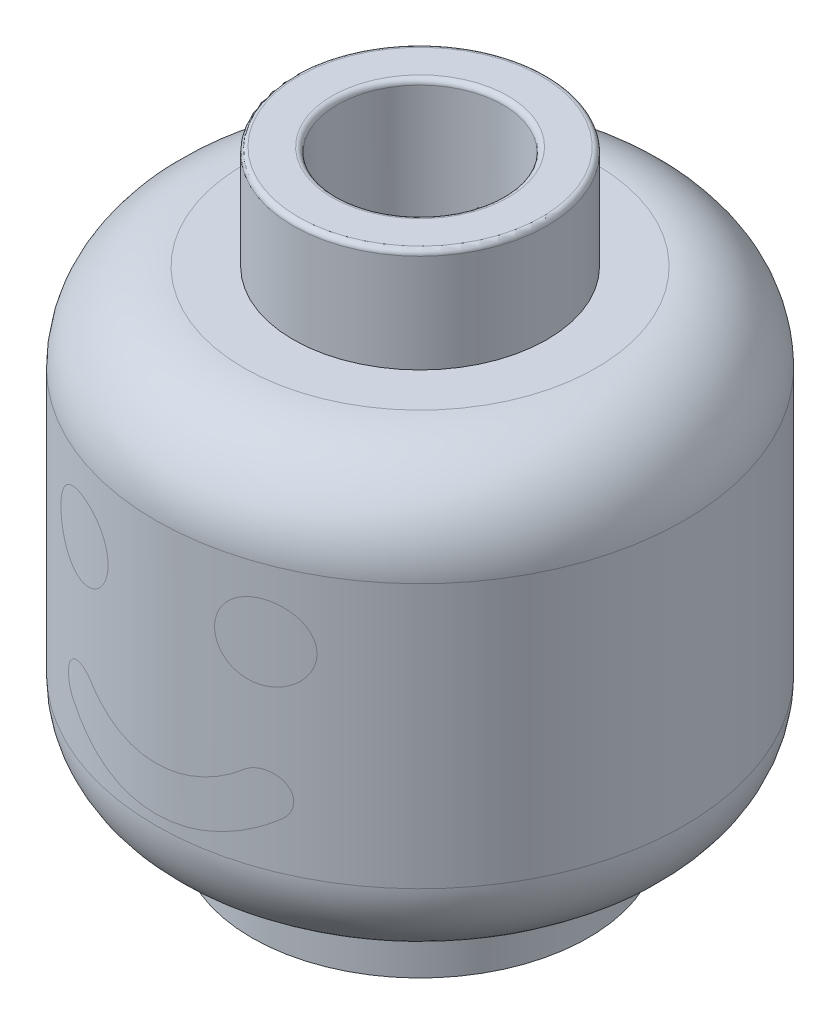
from build123d import *

# Parameters (mm, degrees)
SKETCH2_R           = 5.1
BOSS_EXTRUDE1_DEPTH = 8.5
SKETCH3_R           = 2.45
BOSS_EXTRUDE2_DEPTH = 2
SKETCH4_R           = 1.6
CUT_EXTRUDE1_DEPTH  = 2
FILLET1_R           = 1.7
FILLET2_R           = 0.1
SKETCH5_R           = 3.25
BOSS_EXTRUDE3_DEPTH = 1.1
SKETCH6_R           = 2.45
CUT_EXTRUDE2_DEPTH  = 8.5
CUT_EXTRUDE3_DEPTH  = 1.1


with BuildPart() as part:
    # Sketch2 → Boss-Extrude1 (new body)
    with BuildSketch(Plane(origin=(0, 0, 0), x_dir=(1, 0, 0), z_dir=(0, 1, 0))):
        with Locations(Location((0, 0, 0), (0, 0, 270))):
            Circle(SKETCH2_R)
    extrude(amount=BOSS_EXTRUDE1_DEPTH)

    # Sketch3 → Boss-Extrude2 (add)
    with BuildSketch(Plane(origin=(0, 8.5, 0), x_dir=(1, 0, 0), z_dir=(0, 1, 0))):
        with Locations(Location((0, 0, 0), (0, 0, 270))):
            Circle(SKETCH3_R)
    extrude(amount=BOSS_EXTRUDE2_DEPTH)

    # Sketch4 → Cut-Extrude1 (cut)
    with BuildSketch(Plane(origin=(0, 10.5, 0), x_dir=(1, 0, 0), z_dir=(0, 1, 0))):
        with Locations(Location((0, 0, 0), (0, 0, 270))):
            Circle(SKETCH4_R)
    extrude(amount=-CUT_EXTRUDE1_DEPTH, mode=Mode.SUBTRACT)

    # Fillet1
    fillet1_edges = [part.edges().sort_by_distance(p)[0] for p in [
        (0, 0, -5.1),
        (0, 8.5, -5.1),
    ]]
    fillet(fillet1_edges, radius=FILLET1_R)

    # Fillet2
    fillet2_edges = [part.edges().sort_by_distance(p)[0] for p in [
        (0, 10.5, -1.6),
        (0, 10.5, -2.45),
    ]]
    fillet(fillet2_edges, radius=FILLET2_R)

    # Sketch5 → Boss-Extrude3 (add)
    with BuildSketch(Plane.XZ):
        with Locations(Location((0, 0, 0), (0, 0, 90))):
            Circle(SKETCH5_R)
    extrude(amount=BOSS_EXTRUDE3_DEPTH)

    # Sketch6 → Cut-Extrude2 (cut)
    with BuildSketch(Plane.XZ.offset(1.1)):
        with Locations(Location((0, 0, 0), (0, 0, 90))):
            Circle(SKETCH6_R)
    extrude(amount=-CUT_EXTRUDE2_DEPTH, mode=Mode.SUBTRACT)

    # Sketch11 → Cut-Extrude3 (cut)
    with BuildSketch(Plane(origin=(0, 8.5, 0), x_dir=(1, 0, 0), z_dir=(0, 1, 0))):
        with BuildLine():
            Line((-0.42, 0.240604968), (-0.42, 1.543891188))
            ThreePointArc((-0.42, 1.543891188), (-1.386062698, 0.799268539), (-1.546617211, -0.409847781))
            Line((-1.546617211, -0.409847781), (-0.42, 0.240604968))
        make_face()
        with BuildLine():
            ThreePointArc((1.6, 0), (1.271219887, 0.971596624), (0.42, 1.543891188))
            Line((0.42, 1.543891188), (0.42, 0.240604968))
            Line((0.42, 0.240604968), (1.546617211, -0.409847781))
            ThreePointArc((1.546617211, -0.409847781), (1.586598175, -0.206654861), (1.6, 0))
        make_face()
        with BuildLine():
            Line((0, -0.486856371), (-1.125849182, -1.136865699))
            ThreePointArc((-1.125849182, -1.136865699), (0, -1.6), (1.125849182, -1.136865699))
            Line((1.125849182, -1.136865699), (0, -0.486856371))
        make_face()
    extrude(amount=-CUT_EXTRUDE3_DEPTH, mode=Mode.SUBTRACT)


solid = part.part
